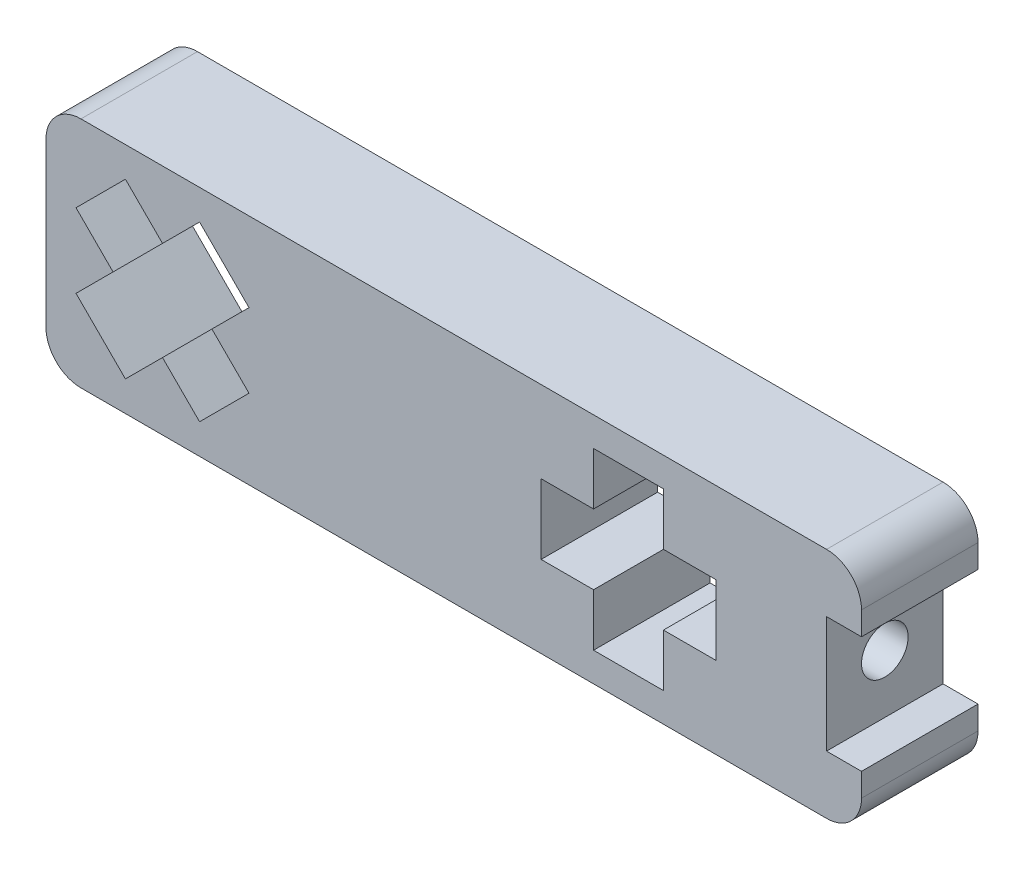
from build123d import *

# Parameters (mm, degrees)
SKETCH1_W           = 60
SKETCH1_H           = 20
BOSS_EXTRUDE5_DEPTH = 10
SKETCH4_W           = 10
SKETCH4_H           = 20
BOSS_EXTRUDE6_DEPTH = 10
SKETCH5_W           = 10
SKETCH5_H           = 10
CUT_EXTRUDE4_DEPTH  = 3
SKETCH6_R           = 2
CUT_EXTRUDE5_DEPTH  = 14
FILLET2_R           = 3


with BuildPart() as part:
    # Sketch1 → Boss-Extrude5 (new body)
    with BuildSketch(Plane.XY):
        Rectangle(SKETCH1_W, SKETCH1_H)
        Polygon((-23.181980124, 7.42462107), (-27.42462133, 3.181980902), (-24.242640893, 3.09e-07), (-27.424621334, -3.181979354), (-23.181981665, -7.424621059), (-20.00000031, -4.242640483), (-16.818019873, -7.424621076), (-12.575378663, -3.181980905), (-15.757358789, 0), (-12.575378649, 3.181979361), (-16.818018342, 7.424621043), (-19.999999246, 4.242640917), align=None, mode=Mode.SUBTRACT)
        Polygon((23, 7.5), (17, 7.5), (17, 3), (12.5, 3), (12.5, -3), (17, -3), (17, -7.5), (23, -7.5), (23, -3), (27.5, -3), (27.5, 3), (23, 3), align=None, mode=Mode.SUBTRACT)
    extrude(amount=BOSS_EXTRUDE5_DEPTH)

    # Sketch4 → Boss-Extrude6 (add)
    with BuildSketch(Plane(origin=(30, 0, 0), x_dir=(0, 0, -1), z_dir=(1, 0, 0))):
        with Locations((-5, 0)):
            Rectangle(SKETCH4_W, SKETCH4_H)
    extrude(amount=BOSS_EXTRUDE6_DEPTH)

    # Sketch5 → Cut-Extrude4 (cut)
    with BuildSketch(Plane(origin=(40, 0, 0), x_dir=(0, 0, -1), z_dir=(1, 0, 0))):
        with Locations((-5, 0)):
            Rectangle(SKETCH5_W, SKETCH5_H)
    extrude(amount=-CUT_EXTRUDE4_DEPTH, mode=Mode.SUBTRACT)

    # Sketch6 → Cut-Extrude5 (cut)
    with BuildSketch(Plane(origin=(37, 0, 0), x_dir=(0, 0, -1), z_dir=(1, 0, 0))):
        with Locations((-5, 0)):
            Circle(SKETCH6_R)
    extrude(amount=-CUT_EXTRUDE5_DEPTH, mode=Mode.SUBTRACT)

    # Fillet2
    fillet2_edges = [part.edges().sort_by_distance(p)[0] for p in [
        (-30, 10, 5),
        (-30, -10, 5),
        (40, 10, 5),
        (40, -10, 5),
    ]]
    fillet(fillet2_edges, radius=FILLET2_R)


solid = part.part
